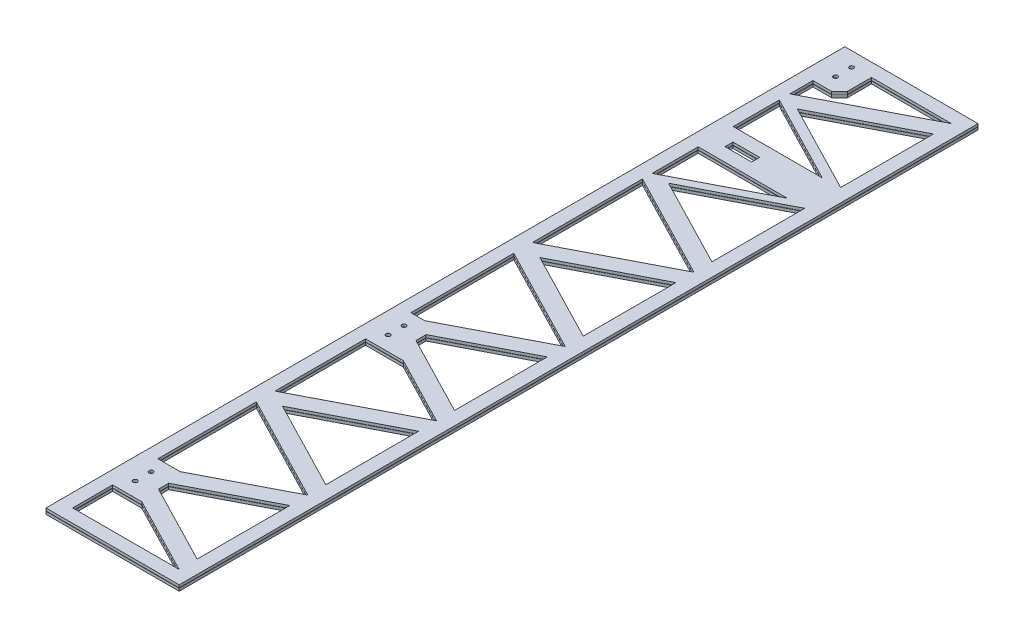
from build123d import *

# Parameters (mm, degrees)
SKETCH_2_W          = 50
SKETCH_2_H          = 1
EXTRUDE_1_DEPTH     = 300
EXTRUDE_1_2_DEPTH   = 300
CUT_EXTRUDE_1_DEPTH = 1078.290028257
SKETCH_4_W          = 10
SKETCH_4_H          = 1.5
CUT_EXTRUDE_2_DEPTH = 10
SKETCH_5_R          = 0.8
CUT_EXTRUDE_3_DEPTH = 1078.290028257


with BuildPart() as part:
    # 草图2 → 凸台-拉伸1 (new body)
    with BuildSketch(Plane.XY.offset(762.01)):
        with Locations((155.787596038, -2.839694097)):
            Rectangle(SKETCH_2_W, SKETCH_2_H)
    extrude(amount=EXTRUDE_1_DEPTH)


with BuildPart() as body_2:
    # 草图2 → Extrude 1 2 (new body)
    with BuildSketch(Plane.XY.offset(762.01)):
        with Locations((155.787596038, -3.939694097)):
            Rectangle(SKETCH_2_W, SKETCH_2_H)
    extrude(amount=EXTRUDE_1_2_DEPTH)


with BuildPart() as cut_extrude_1_tool:
    # 草图3 → 切除-拉伸1 (new, through all)
    with BuildSketch(Plane(origin=(0, -2.339694097, 0), x_dir=(1, 0, 0), z_dir=(0, 1, 0))):
        Polygon((135.787596038, -1057.01), (175.787596038, -1057.01), (146.755337973, -1042.01), (135.787596038, -1042.01), align=None)
        Polygon((145.783189251, -1034.754205558), (175.787596038, -1050.256482398), (175.787596038, -1015.430184269), (145.787596038, -1030.930184269), align=None)
        Polygon((144.174692812, -1025.01), (175.787596038, -1008.676666667), (135.787596038, -988.01), (135.787596038, -1025.01), align=None)
        Polygon((142.08472688, -984.51), (175.787596038, -1001.923149065), (175.787596038, -967.096850935), align=None)
        Polygon((135.787596038, -947.01), (135.787596038, -981.01), (175.787596038, -960.343333333), (149.981144425, -947.01), align=None)
        Polygon((145.787596038, -938.089815731), (175.787596038, -953.589815731), (175.787596038, -918.763517602), (145.787596038, -934.263517602), align=None)
        Polygon((140.968302675, -929.999968238), (175.787596038, -912.01), (135.787596038, -891.343333333), (135.787596038, -930.01), align=None)
        Polygon((142.08472688, -887.843333333), (175.787596038, -905.256482398), (175.787596038, -870.430184269), align=None)
        Polygon((135.787596038, -843.01), (135.787596038, -884.343333333), (175.787596038, -863.676666667), align=None)
        Polygon((142.08472688, -839.51), (175.787596038, -856.923149065), (175.787596038, -822.096850935), align=None)
        Polygon((135.787596038, -779.01), (135.787596038, -787.676666667), (175.787596038, -767.01), (145.787596038, -767.01), (145.787596038, -776.01), (142.787596038, -779.01), align=None)
        Polygon((142.08472688, -791.176666667), (175.787596038, -808.589815731), (175.787596038, -773.763517602), align=None)
    extrude(amount=-CUT_EXTRUDE_1_DEPTH)


with BuildPart() as part_1:
    add(part.part)

    # 切除-拉伸1: cut by cut_extrude_1_tool
    add(cut_extrude_1_tool.part, mode=Mode.SUBTRACT)


with BuildPart() as body_2_1:
    add(body_2.part)

    # 切除-拉伸1: cut by cut_extrude_1_tool
    add(cut_extrude_1_tool.part, mode=Mode.SUBTRACT)


with BuildPart() as cut_extrude_2_tool:
    # 草图4 → 切除-拉伸2 (new body)
    with BuildSketch(Plane.XZ.offset(4.439694097)):
        with Locations((145.787596038, 814.76)):
            Rectangle(SKETCH_4_W, SKETCH_4_H)
        with Locations((145.787596038, 816.26)):
            Rectangle(SKETCH_4_W, SKETCH_4_H)
        Polygon((135.787596038, 791.633241199), (169.251933842, 808.923149065), (135.787596038, 808.923149065), align=None)
        Polygon((135.787596038, 822.096850935), (169.251933842, 822.096850935), (135.787596038, 839.386758801), align=None)
    extrude(amount=-CUT_EXTRUDE_2_DEPTH)


with BuildPart() as part_2:
    add(part_1.part)

    # 切除-拉伸2: cut by cut_extrude_2_tool
    add(cut_extrude_2_tool.part, mode=Mode.SUBTRACT)


with BuildPart() as body_2_2:
    add(body_2_1.part)

    # 切除-拉伸2: cut by cut_extrude_2_tool
    add(cut_extrude_2_tool.part, mode=Mode.SUBTRACT)


with BuildPart() as cut_extrude_3_tool:
    # 草图5 → 切除-拉伸3 (new, through all)
    with BuildSketch(Plane(origin=(0, -2.339694097, 0), x_dir=(1, 0, 0), z_dir=(0, 1, 0))):
        with Locations(Location((138.781173313, -1036.499517206, 0), (0, 0, 180))):
            Circle(SKETCH_5_R)
        with Locations((124.781173313, -1036.499517206)):
            Circle(SKETCH_5_R)
        with Locations((124.781173313, -1030.499517206)):
            Circle(SKETCH_5_R)
        with Locations(Location((138.781173313, -1030.499517206, 0), (0, 0, 180))):
            Circle(SKETCH_5_R)
        with Locations((124.781173313, -935.499517206)):
            Circle(SKETCH_5_R)
        with Locations(Location((138.781173313, -935.499517206, 0), (0, 0, 180))):
            Circle(SKETCH_5_R)
        with Locations(Location((138.781173313, -941.499517206, 0), (0, 0, 180))):
            Circle(SKETCH_5_R)
        with Locations((124.781173313, -941.499517206)):
            Circle(SKETCH_5_R)
        with Locations((124.781173313, -767.499517206)):
            Circle(SKETCH_5_R)
        with Locations(Location((138.781173313, -767.499517206, 0), (0, 0, 180))):
            Circle(SKETCH_5_R)
        with Locations(Location((138.781173313, -773.499517206, 0), (0, 0, 180))):
            Circle(SKETCH_5_R)
        with Locations((124.781173313, -773.499517206)):
            Circle(SKETCH_5_R)
    extrude(amount=-CUT_EXTRUDE_3_DEPTH)


with BuildPart() as part_3:
    add(part_2.part)

    # 切除-拉伸3: cut by cut_extrude_3_tool
    add(cut_extrude_3_tool.part, mode=Mode.SUBTRACT)


with BuildPart() as body_2_3:
    add(body_2_2.part)

    # 切除-拉伸3: cut by cut_extrude_3_tool
    add(cut_extrude_3_tool.part, mode=Mode.SUBTRACT)


solid = Compound([part_3.part, body_2_3.part])
